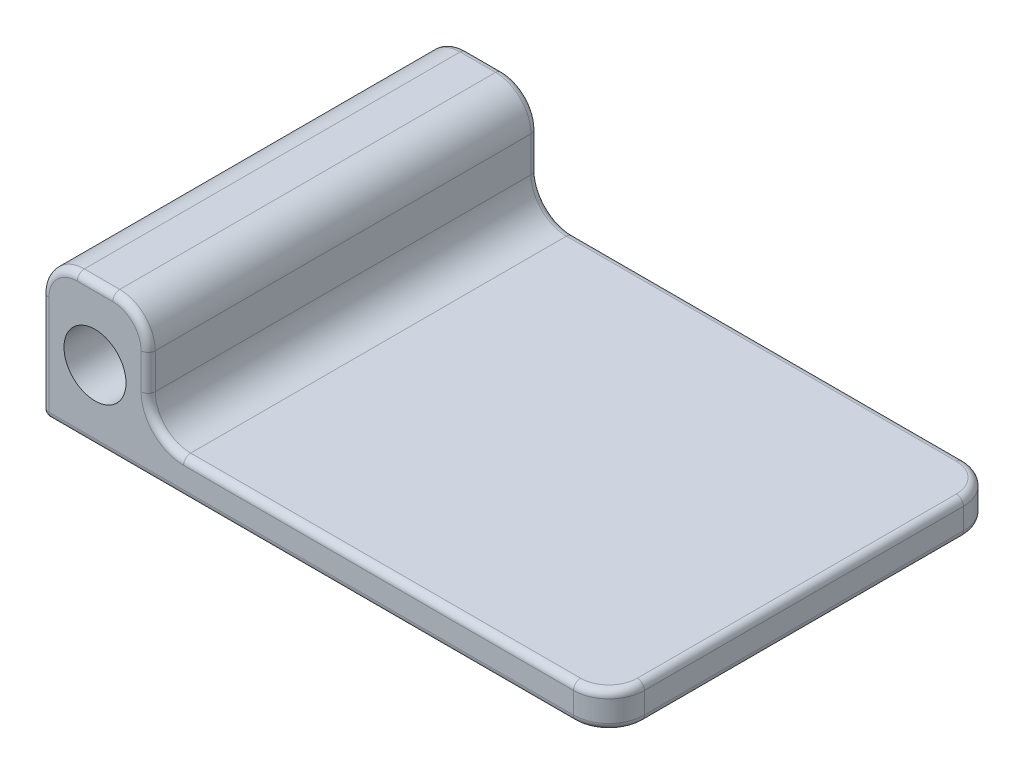
from build123d import *

# Parameters (mm, degrees)
SKETCH1_W           = 203.2
SKETCH1_H           = 139.7
BOSS_EXTRUDE1_DEPTH = 50.8
SKETCH2_W           = 165.1
SKETCH2_H           = 38.1
CUT_EXTRUDE1_DEPTH  = 181.05357536
SKETCH3_R           = 11.1125
CUT_EXTRUDE2_DEPTH  = 181.05357536
FILLET1_R           = 12.7
FILLET3_R           = 12.7
FILLET2_R           = 2.54


with BuildPart() as part:
    # Sketch1 → Boss-Extrude1 (new body)
    with BuildSketch(Plane(origin=(0, 0, 0), x_dir=(1, 0, 0), z_dir=(0, 1, 0))):
        Rectangle(SKETCH1_W, SKETCH1_H)
    extrude(amount=BOSS_EXTRUDE1_DEPTH)

    # Sketch2 → Cut-Extrude1 (cut, through all)
    with BuildSketch(Plane.XY.offset(69.85)):
        with Locations((19.05, 31.75)):
            Rectangle(SKETCH2_W, SKETCH2_H)
    extrude(amount=-CUT_EXTRUDE1_DEPTH, mode=Mode.SUBTRACT)

    # Sketch3 → Cut-Extrude2 (cut, through all)
    with BuildSketch(Plane.XY.offset(69.85)):
        with Locations((-82.55, 25.4)):
            Circle(SKETCH3_R)
    extrude(amount=-CUT_EXTRUDE2_DEPTH, mode=Mode.SUBTRACT)

    # Fillet1
    fillet1_edges = [part.edges().sort_by_distance(p)[0] for p in [
        (-101.6, 50.8, 0),
        (-63.5, 12.7, 0),
        (-63.5, 50.8, 0),
    ]]
    fillet(fillet1_edges, radius=FILLET1_R)

    # Fillet3
    fillet3_edges = [part.edges().sort_by_distance(p)[0] for p in [
        (101.6, 6.35, 69.85),
        (101.6, 6.35, -69.85),
    ]]
    fillet(fillet3_edges, radius=FILLET3_R)

    # Fillet2
    fillet2_edges = [part.edges().sort_by_distance(p)[0] for p in [
        (19.05, 12.7, 69.85),
        (19.05, 12.7, -69.85),
        (-63.5, 31.75, 69.85),
        (-63.5, 31.75, -69.85),
        (-82.55, 50.8, -69.85),
        (-82.55, 50.8, 69.85),
        (-101.6, 19.05, 69.85),
        (-67.219743879, 47.080256121, 69.85),
        (-97.880256121, 47.080256121, 69.85),
        (-101.6, 19.05, -69.85),
        (-67.219743879, 47.080256121, -69.85),
        (-97.880256121, 47.080256121, -69.85),
        (-59.780256121, 16.419743879, 69.85),
        (-59.780256121, 16.419743879, -69.85),
        (-6.35, 0, 69.85),
        (-101.6, 0, 0),
        (-6.35, 0, -69.85),
        (101.6, 0, 0),
        (97.880256121, 0, 66.130256121),
        (97.880256121, 0, -66.130256121),
        (101.6, 12.7, 0),
        (97.880256121, 12.7, 66.130256121),
        (97.880256121, 12.7, -66.130256121),
    ]]
    fillet(fillet2_edges, radius=FILLET2_R)


solid = part.part
